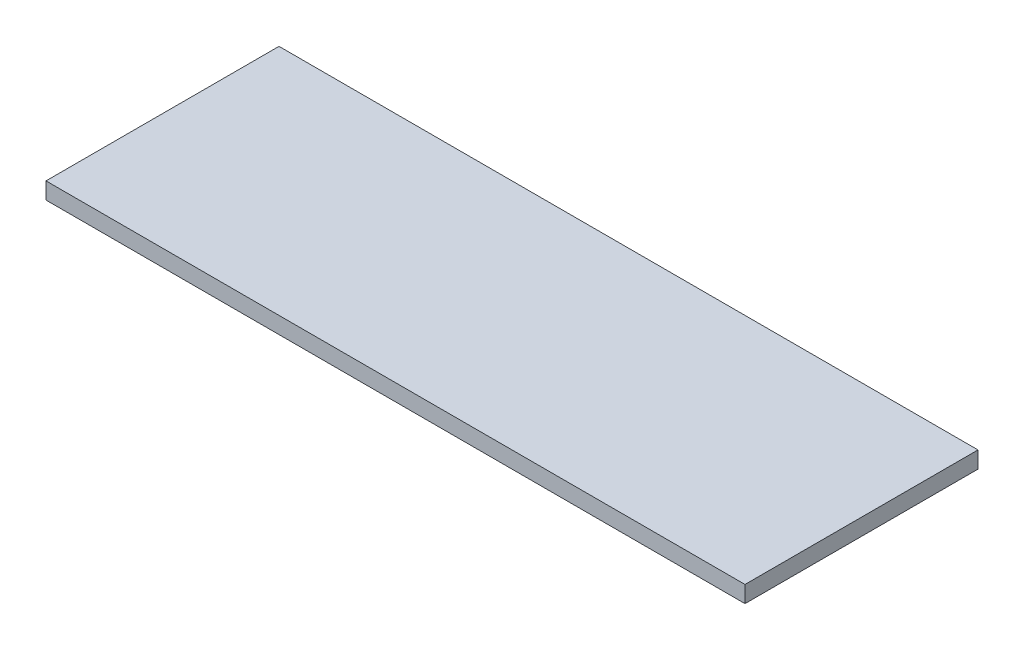
from build123d import *

# Parameters (mm, degrees)
SKETCH_1_W      = 42
SKETCH_1_H      = 14
EXTRUDE_1_DEPTH = 1


with BuildPart() as part:
    # 草图1 → 凸台-拉伸1 (new body)
    with BuildSketch(Plane(origin=(0, 0, 0), x_dir=(1, 0, 0), z_dir=(0, 1, 0))):
        Rectangle(SKETCH_1_W, SKETCH_1_H)
    extrude(amount=EXTRUDE_1_DEPTH)


solid = part.part
